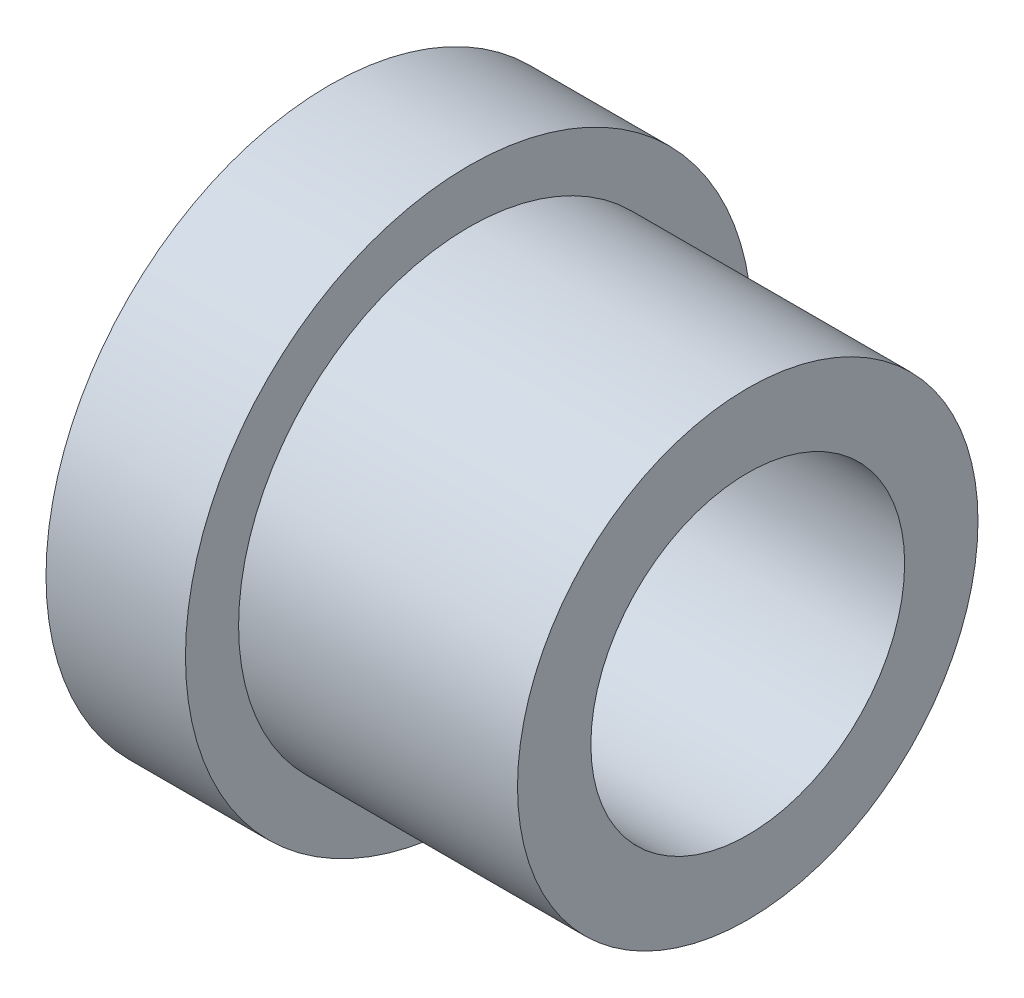
from build123d import *


with BuildPart() as part:
    # Sketch1 → Revolve1 (revolve)
    with BuildSketch(Plane(origin=(0, 0, 0), x_dir=(1, 0, 0), z_dir=(0, 1, 0)), mode=Mode.PRIVATE) as revolve1_sk:
        Polygon((0, 5), (0, 20.32), (10, 20.32), (10, 16.51), (30, 16.51), (30, 11.25), (13.5, 11.25), (13.5, 8.6), (12, 8.6), (12, 5), align=None)
    revolve(revolve1_sk.sketch.rotate(Axis((0, 0, 0), (1, 0, 0)), 180), axis=Axis((0, 0, 0), (1, 0, 0)))


solid = part.part
